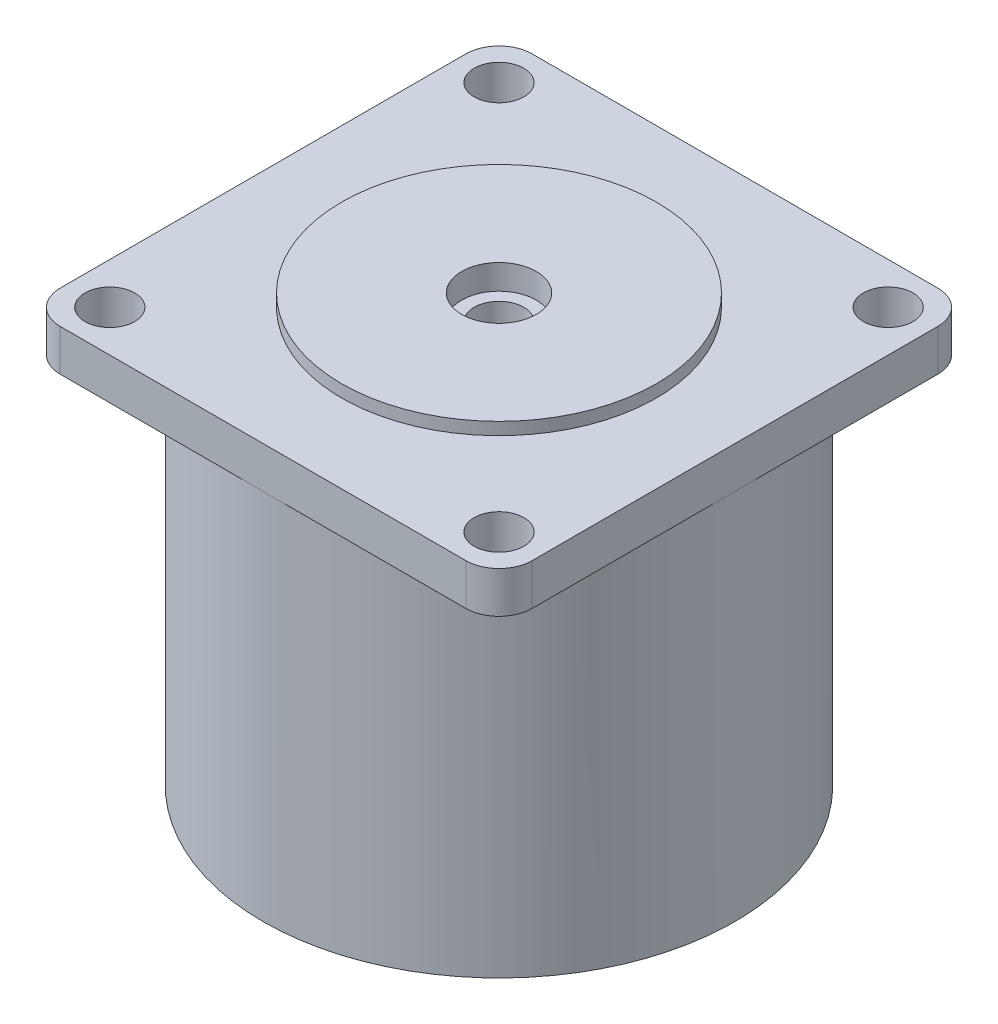
from build123d import *

# Parameters (mm, degrees)
BOSS_EXTRUDE1_DEPTH = 5
FILLET1_R           = 4
SKETCH2_R           = 3
CUT_EXTRUDE1_DEPTH  = 41.614036982
SKETCH3_R           = 28.5
BOSS_EXTRUDE2_DEPTH = 45
SKETCH4_R           = 19
BOSS_EXTRUDE3_DEPTH = 1.5
SKETCH5_R           = 4.5
CUT_EXTRUDE2_DEPTH  = 3
SKETCH6_R           = 3
CUT_EXTRUDE3_DEPTH  = 64.06147794


with BuildPart() as part:
    # Sketch1 → Boss-Extrude1 (new body)
    with BuildSketch(Plane(origin=(0, 0, 0), x_dir=(1, 0, 0), z_dir=(0, 1, 0))):
        Polygon((-28.5, 0), (-28.5, 28.5), (28.5, 28.5), (28.5, -28.5), (-28.5, -28.5), align=None)
    extrude(amount=BOSS_EXTRUDE1_DEPTH)

    # Fillet1
    fillet1_edges = [part.edges().sort_by_distance(p)[0] for p in [
        (-28.5, 2.5, -28.5),
        (28.5, 2.5, -28.5),
        (28.5, 2.5, 28.5),
        (-28.5, 2.5, 28.5),
    ]]
    fillet(fillet1_edges, radius=FILLET1_R)

    # Sketch2 → Cut-Extrude1 (cut, through all)
    with BuildSketch(Plane(origin=(0, 5, 0), x_dir=(1, 0, 0), z_dir=(0, 1, 0))):
        with Locations(Location((-23.5, 23.5, 0), (0, 0, 270))):
            Circle(SKETCH2_R)
        with Locations(Location((23.5, 23.5, 0), (0, 0, 270))):
            Circle(SKETCH2_R)
        with Locations(Location((23.5, -23.5, 0), (0, 0, 270))):
            Circle(SKETCH2_R)
        with Locations(Location((-23.5, -23.5, 0), (0, 0, 270))):
            Circle(SKETCH2_R)
    extrude(amount=-CUT_EXTRUDE1_DEPTH, mode=Mode.SUBTRACT)

    # Sketch3 → Boss-Extrude2 (add)
    with BuildSketch(Plane.XZ):
        with Locations(Location((0, 0, 0), (0, 0, 270))):
            Circle(SKETCH3_R)
    extrude(amount=BOSS_EXTRUDE2_DEPTH)

    # Sketch4 → Boss-Extrude3 (add)
    with BuildSketch(Plane(origin=(0, 5, 0), x_dir=(1, 0, 0), z_dir=(0, 1, 0))):
        with Locations(Location((0, 0, 0), (0, 0, 90))):
            Circle(SKETCH4_R)
    extrude(amount=BOSS_EXTRUDE3_DEPTH)

    # Sketch5 → Cut-Extrude2 (cut)
    with BuildSketch(Plane(origin=(0, 6.5, 0), x_dir=(1, 0, 0), z_dir=(0, 1, 0))):
        with Locations(Location((0, 0, 0), (0, 0, 270))):
            Circle(SKETCH5_R)
    extrude(amount=-CUT_EXTRUDE2_DEPTH, mode=Mode.SUBTRACT)

    # Sketch6 → Cut-Extrude3 (cut, through all)
    with BuildSketch(Plane(origin=(0, 3.5, 0), x_dir=(1, 0, 0), z_dir=(0, 1, 0))):
        with Locations(Location((0, 0, 0), (0, 0, 270))):
            Circle(SKETCH6_R)
    extrude(amount=-CUT_EXTRUDE3_DEPTH, mode=Mode.SUBTRACT)


solid = part.part
